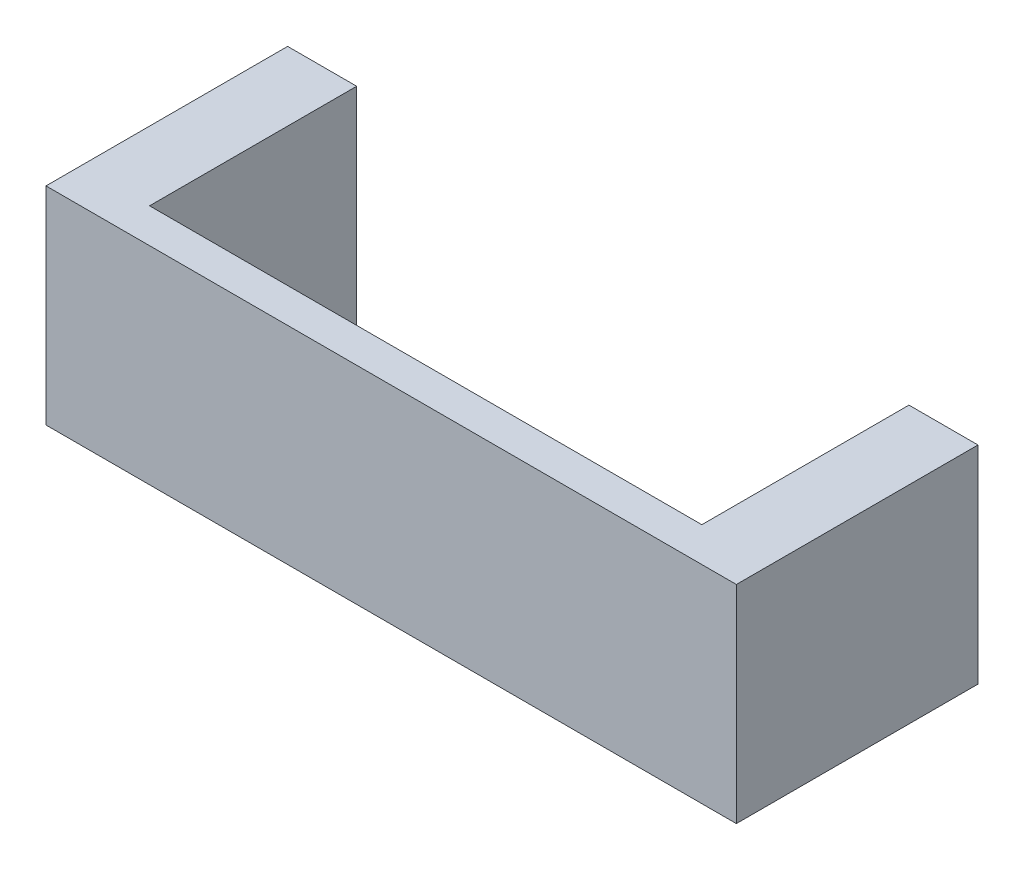
from build123d import *

# Parameters (mm, degrees)
BOSS_EXTRUDE1_DEPTH = 30


with BuildPart() as part:
    # Sketch1 → Boss-Extrude1 (new body)
    with BuildSketch(Plane(origin=(0, 0, 0), x_dir=(1, 0, 0), z_dir=(0, 1, 0))):
        Polygon((-50, 0), (-40, 0), (-40, -30), (40, -30), (40, 0), (50, 0), (50, -35), (-50, -35), align=None)
    extrude(amount=BOSS_EXTRUDE1_DEPTH)


solid = part.part
